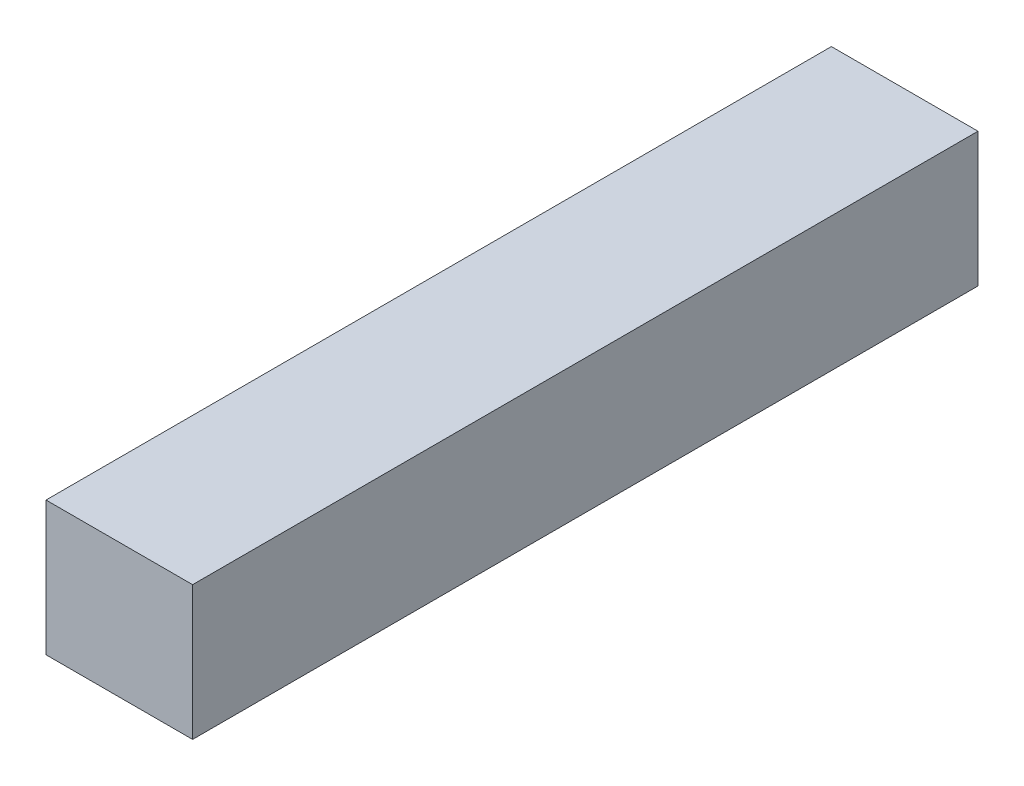
from build123d import *

# Parameters (mm, degrees)
ESBO_O1_W                = 14
ESBO_O1_H                = 12.8
RESSALTO_EXTRUS_O1_DEPTH = 75


with BuildPart() as part:
    # Esboço1 → Ressalto-extrusão1 (new body)
    with BuildSketch(Plane.XY):
        with Locations((7, 6.4)):
            Rectangle(ESBO_O1_W, ESBO_O1_H)
    extrude(amount=RESSALTO_EXTRUS_O1_DEPTH)


solid = part.part
